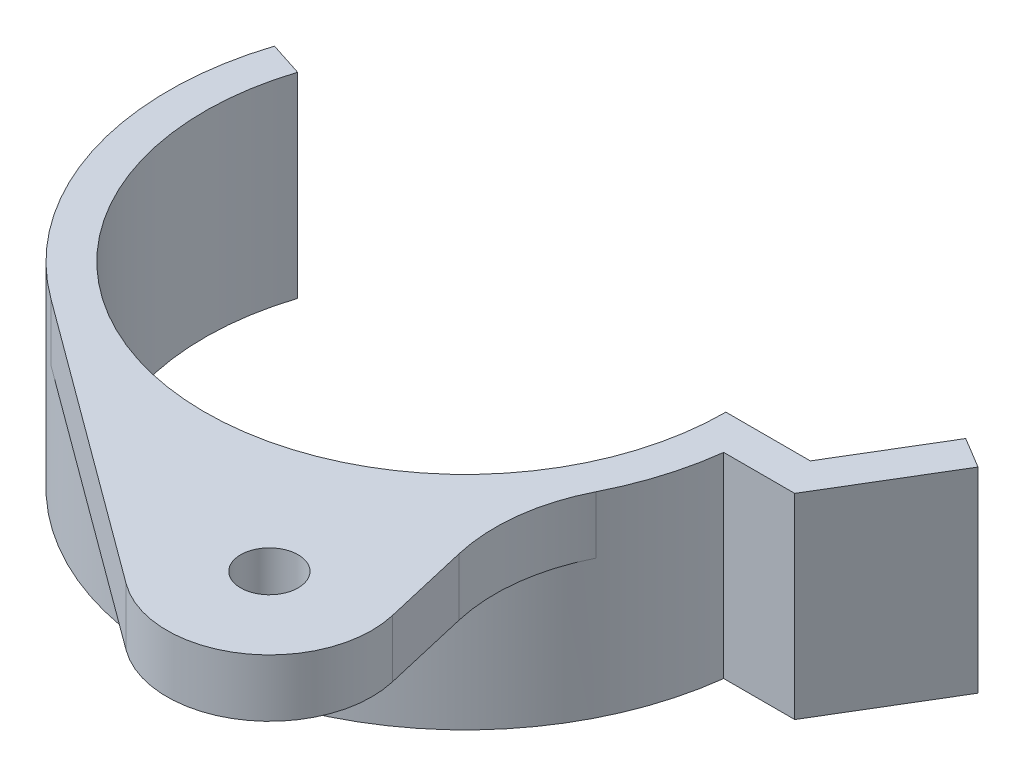
from build123d import *

# Parameters (mm, degrees)
BOSS_EXTRUDE1_DEPTH = 109
BOSS_EXTRUDE2_DEPTH = 32
FILLET1_R           = 100
SKETCH4_R           = 16
CUT_EXTRUDE1_DEPTH  = 32


with BuildPart() as part:
    # Sketch2 → Boss-Extrude1 (new body)
    with BuildSketch(Plane(origin=(0, 0, 0), x_dir=(1, 0, 0), z_dir=(0, 1, 0))):
        with BuildLine():
            Line((0, 0), (47, 0))
            Line((47, 0), (79.447398719, 54.001539944))
            Line((79.447398719, 54.001539944), (96.590744733, 43.700778446))
            Line((96.590744733, 43.700778446), (58.315455564, -20))
            Line((58.315455564, -20), (18.783393542, -20))
            ThreePointArc((18.783393542, -20), (-180.560657841, -161.122436718), (-301.98658219, 50.79579719))
            Line((-301.98658219, 50.79579719), (-282.957905561, 44.638730864))
            ThreePointArc((-282.957905561, 44.638730864), (-167.595394372, -143.228656885), (0, 0))
        make_face()
    extrude(amount=-BOSS_EXTRUDE1_DEPTH)

    # Sketch3 → Boss-Extrude2 (add)
    with BuildSketch(Plane(origin=(0, 0, 0), x_dir=(1, 0, 0), z_dir=(0, 1, 0))):
        with BuildLine():
            Line((-242.764114638, -132.917936671), (-84.068153885, -249.642364452))
            ThreePointArc((-84.068153885, -249.642364452), (-18.943420898, -251.328541106), (5.227532222, -190.83193737))
            Line((5.227532222, -190.83193737), (-15.378785599, -102.094763712))
            ThreePointArc((-15.378785599, -102.094763712), (-122.836162355, -163.504630824), (-242.764114638, -132.917936671))
        make_face()
    extrude(amount=-BOSS_EXTRUDE2_DEPTH)

    # Fillet1
    fillet1_edges = [part.edges().sort_by_distance(p)[0] for p in [
        (-15.378785599, -16, 102.094763712),
    ]]
    fillet(fillet1_edges, radius=FILLET1_R)

    # Sketch4 → Cut-Extrude1 (cut)
    with BuildSketch(Plane(origin=(0, 0, 0), x_dir=(1, 0, 0), z_dir=(0, 1, 0))):
        with Locations(Location((-50.295096101, -203.725259056, 0), (0, 0, 270))):
            Circle(SKETCH4_R)
    extrude(amount=-CUT_EXTRUDE1_DEPTH, mode=Mode.SUBTRACT)


solid = part.part
